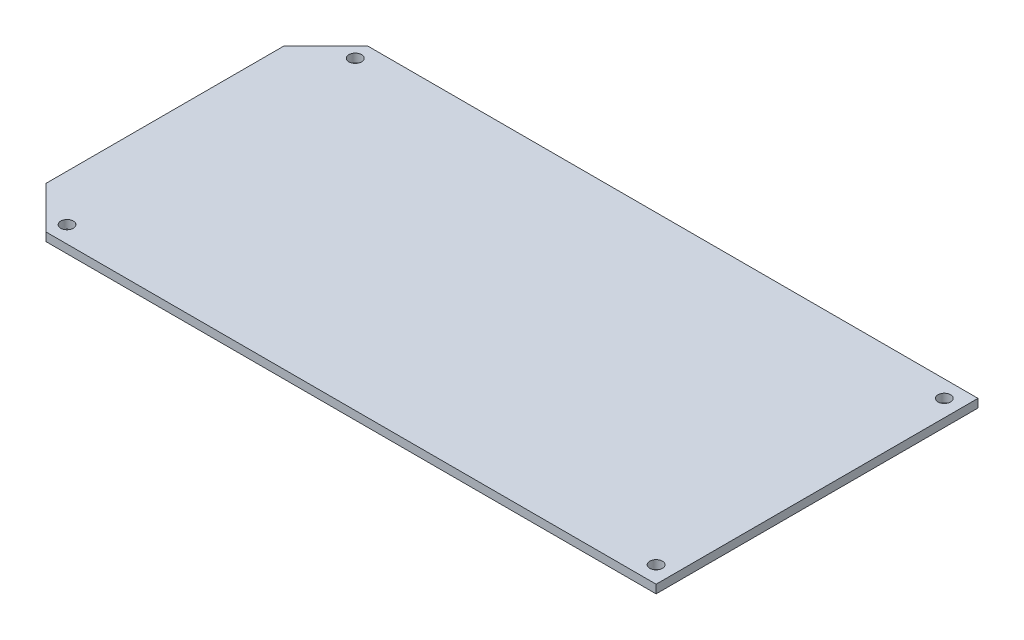
from build123d import *

# Parameters (mm, degrees)
SKETCH1_W           = 155
SKETCH1_H           = 76.5
BOSS_EXTRUDE1_DEPTH = 2
SKETCH2_R           = 1.5
CUT_EXTRUDE1_DEPTH  = 87.448322714
CHAMFER1_SIZE       = 10


with BuildPart() as part:
    # Sketch1 → Boss-Extrude1 (new body)
    with BuildSketch(Plane(origin=(0, 0, 0), x_dir=(1, 0, 0), z_dir=(0, 1, 0))):
        Rectangle(SKETCH1_W, SKETCH1_H)
    extrude(amount=BOSS_EXTRUDE1_DEPTH)

    # Sketch2 → Cut-Extrude1 (cut, through all)
    with BuildSketch(Plane(origin=(0, 2, 0), x_dir=(1, 0, 0), z_dir=(0, 1, 0))):
        with Locations(Location((73.5, 34.25, 0), (0, 0, 270))):
            Circle(SKETCH2_R)
        with Locations(Location((73.5, -34.25, 0), (0, 0, 270))):
            Circle(SKETCH2_R)
        with Locations(Location((-66.5, -34.25, 0), (0, 0, 270))):
            Circle(SKETCH2_R)
        with Locations(Location((-66.5, 34.25, 0), (0, 0, 270))):
            Circle(SKETCH2_R)
    extrude(amount=-CUT_EXTRUDE1_DEPTH, mode=Mode.SUBTRACT)

    # Chamfer1
    chamfer1_edges = [part.edges().sort_by_distance(p)[0] for p in [
        (-77.5, 1, 38.25),
        (-77.5, 1, -38.25),
    ]]
    chamfer(chamfer1_edges, length=CHAMFER1_SIZE)


solid = part.part
